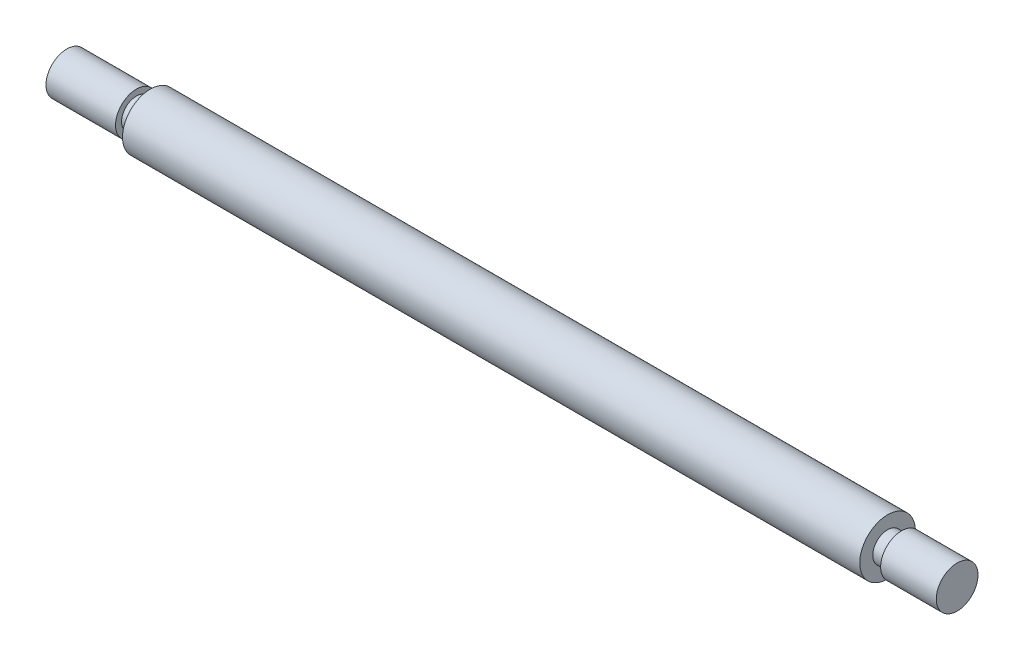
from build123d import *


with BuildPart() as part:
    # Croquis1 → Revolución1 (revolve)
    with BuildSketch(Plane.XY, mode=Mode.PRIVATE) as revoluci_n1_sk:
        Polygon((0, 0), (0, 0.1875), (0.625, 0.1875), (0.625, 0.1334), (0.75, 0.1334), (0.75, 0.25), (7.375, 0.25), (7.375, 0.1334), (7.5, 0.1334), (7.5, 0.1875), (8, 0.1875), (8, 0), align=None)
    revolve(revoluci_n1_sk.sketch.rotate(Axis((8, 0, 0), (-1, 0, 0)), 90), axis=Axis((8, 0, 0), (-1, 0, 0)))


solid = part.part
